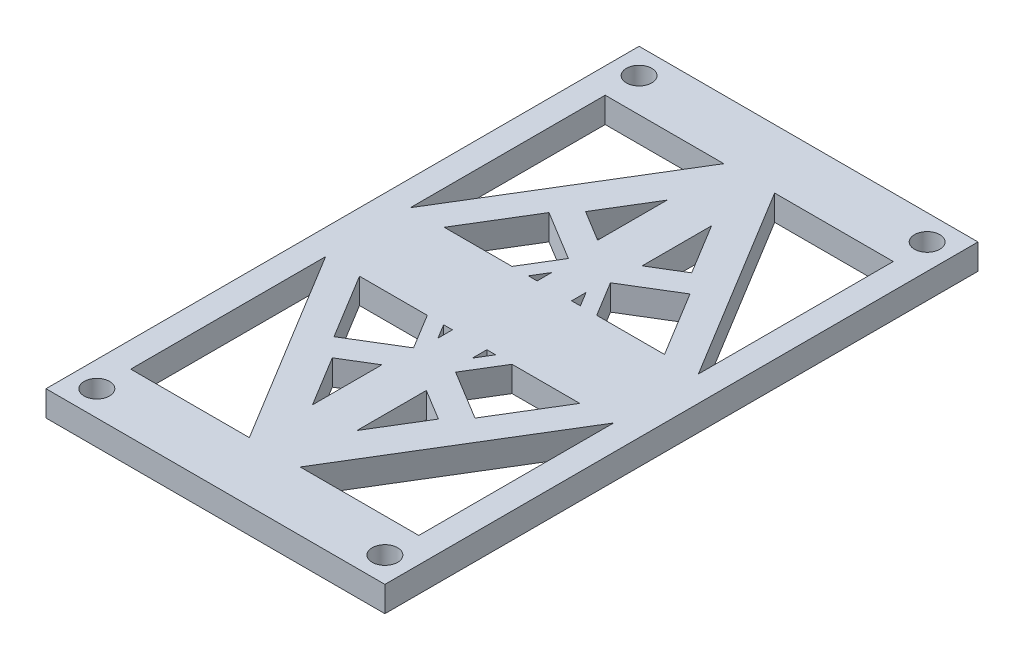
from build123d import *

# Parameters (mm, degrees)
SKETCH_1_W          = 40
SKETCH_1_H          = 70
EXTRUDE_1_DEPTH     = 3
SKETCH_2_R          = 1.5
CUT_EXTRUDE_1_DEPTH = 3
CHAMFER_1_SIZE      = 0.5
CUT_EXTRUDE_2_DEPTH = 3


with BuildPart() as part:
    # 草图1 → 凸台-拉伸1 (new body)
    with BuildSketch(Plane(origin=(0, 0, 0), x_dir=(1, 0, 0), z_dir=(0, 1, 0))):
        Rectangle(SKETCH_1_W, SKETCH_1_H)
    extrude(amount=EXTRUDE_1_DEPTH)

    # 草图2 → 切除-拉伸1 (cut)
    with BuildSketch(Plane(origin=(0, 3, 0), x_dir=(1, 0, 0), z_dir=(0, 1, 0))):
        with Locations(Location((-17, 32, 0), (0, 0, 270))):
            Circle(SKETCH_2_R)
        with Locations(Location((-17, -32, 0), (0, 0, 270))):
            Circle(SKETCH_2_R)
        with Locations(Location((17, 32, 0), (0, 0, 270))):
            Circle(SKETCH_2_R)
        with Locations(Location((17, -32, 0), (0, 0, 270))):
            Circle(SKETCH_2_R)
    extrude(amount=-CUT_EXTRUDE_1_DEPTH, mode=Mode.SUBTRACT)

    # 倒角1
    chamfer_1_edges = [part.edges().sort_by_distance(p)[0] for p in [
        (-17, 0, 30.5),
        (17, 0, -33.5),
        (17, 0, 30.5),
        (-17, 0, -33.5),
    ]]
    chamfer(chamfer_1_edges, length=CHAMFER_1_SIZE)

    # 草图3 → 切除-拉伸2 (cut)
    with BuildSketch(Plane(origin=(0, 3, 0), x_dir=(1, 0, 0), z_dir=(0, 1, 0))):
        Polygon((-17, 28), (-17, 5), (-3, 28), align=None)
        Polygon((-2.622834476, 20.926536493), (-6.262463104, 14.947146604), (-2.622834476, 12.731720482), align=None)
        Polygon((-8.320477478, 12.687787001), (-2.483236099, 9.134683552), (-5, 5), (-13, 5), align=None)
        Polygon((-2.032840116, 6.708397111), (-3.07273401, 5), (-2.032840116, 5), align=None)
        Polygon((3.07273401, 5), (2.032840116, 5), (2.032840116, 6.708397111), align=None)
        Polygon((5, 5), (13, 5), (8.320477478, 12.687787001), (2.483236099, 9.134683552), align=None)
        Polygon((6.262463104, 14.947146604), (2.622834476, 12.731720482), (2.622834476, 20.926536493), align=None)
        Polygon((17, 5), (3, 28), (17, 28), align=None)
        Polygon((2.032840116, -6.708397111), (3.07273401, -5), (2.032840116, -5), align=None)
        Polygon((-3.07273401, -5), (-2.032840116, -5), (-2.032840116, -6.708397111), align=None)
        Polygon((2.483236099, -9.134683552), (5, -5), (13, -5), (8.320477478, -12.687787001), align=None)
        Polygon((-5, -5), (-13, -5), (-8.320477478, -12.687787001), (-2.483236099, -9.134683552), align=None)
        Polygon((-6.262463104, -14.947146604), (-2.622834476, -12.731720482), (-2.622834476, -20.926536493), align=None)
        Polygon((2.622834476, -20.926536493), (6.262463104, -14.947146604), (2.622834476, -12.731720482), align=None)
        Polygon((17, -28), (17, -5), (3, -28), align=None)
        Polygon((-17, -5), (-3, -28), (-17, -28), align=None)
    extrude(amount=-CUT_EXTRUDE_2_DEPTH, mode=Mode.SUBTRACT)


solid = part.part
